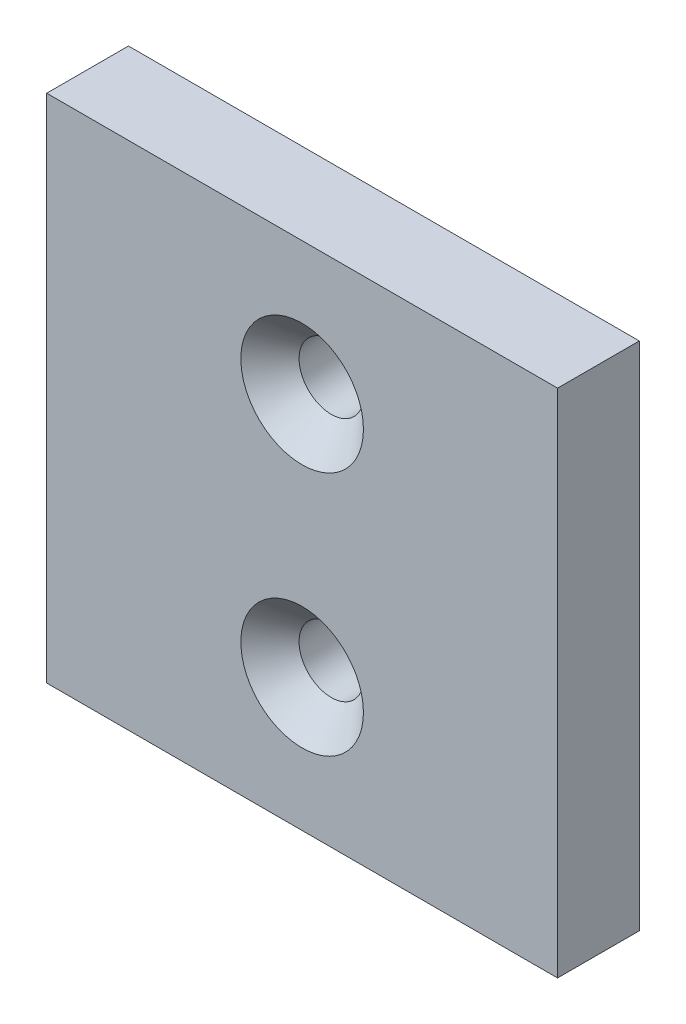
from build123d import *

# Parameters (mm, degrees)
SKETCH1_W           = 50
SKETCH1_H           = 50
BOSS_EXTRUDE1_DEPTH = 8
HOLE1_D             = 6.3
HOLE1_CSINK_D       = 12
HOLE1_CSINK_ANGLE   = 90


with BuildPart() as part:
    # Sketch1 → Boss-Extrude1 (new body)
    with BuildSketch(Plane.XY):
        Rectangle(SKETCH1_W, SKETCH1_H)
    extrude(amount=BOSS_EXTRUDE1_DEPTH)

    # Hole1 (through all)
    with Locations(Plane(origin=(0, 12, 8), x_dir=(1, 0, 0), z_dir=(0, 0, 1))):
        with Locations((0, 0), (0, -24)):
            CounterSinkHole(HOLE1_D / 2, HOLE1_CSINK_D / 2, counter_sink_angle=HOLE1_CSINK_ANGLE)


solid = part.part
